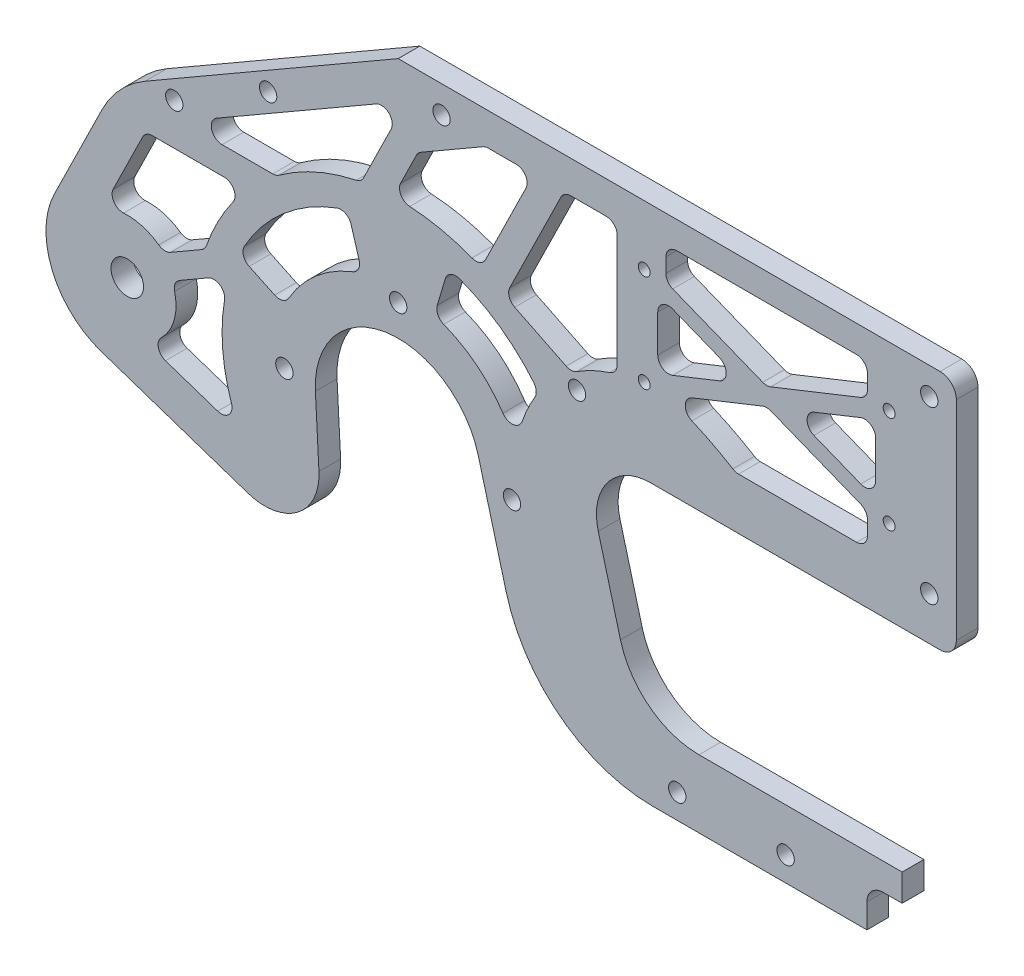
from build123d import *

# Parameters (mm, degrees)
SKETCH_1_R           = 15.3
SKETCH_1_R_2         = 3
EXTRUDE_1_DEPTH      = 4
SKETCH_2_R           = 1.6
CUT_EXTRUDE_1_DEPTH  = 120.268604419
FILLET_1_R           = 10
FILLET_2_R           = 15
SKETCH_3_R           = 1.1
CUT_EXTRUDE_2_DEPTH  = 120.268604419
CUT_EXTRUDE_4_DEPTH  = 120.268604419
SKETCH_8_R           = 1.6
CUT_EXTRUDE_7_DEPTH  = 120.268604419
SKETCH_10_W          = 6.5
SKETCH_10_H          = 7.5
CUT_EXTRUDE_8_DEPTH  = 120.268604419
SKETCH_17_R          = 1.6
CUT_EXTRUDE_14_DEPTH = 120.268604419
FILLET_3_R           = 3
CUT_EXTRUDE_13_DEPTH = 120.268604419
FILLET_5_R           = 10
FILLET_6_R           = 28
FILLET_7_R           = 2
CUT_EXTRUDE_15_DEPTH = 10
FILLET_8_R           = 2
FILLET_9_R           = 3
FILLET_10_R          = 20
SKETCH_20_R          = 1.6
CUT_EXTRUDE_16_DEPTH = 120.268604559


with BuildPart() as part:
    # 草图1 → 凸台-拉伸1 (new body)
    with BuildSketch(Plane.XY):
        with BuildLine():
            Line((103, 60), (0, 60))
            Line((0, 60), (-51.961524227, 30))
            Line((-51.961524227, 30), (-63.460189368, 6.619917082))
            ThreePointArc((-63.460189368, 6.619917082), (-63.846826311, -5.767616589), (-54.78066704, -14.217778401))
            Line((-54.78066704, -14.217778401), (10, -36))
            Line((10, -36), (93, -36))
            Line((93, -36), (93, -23.5))
            Line((93, -23.5), (44, -23.5))
            Line((44, -23.5), (33.549981495, 15.5))
            Line((33.549981495, 15.5), (103, 15.5))
            Line((103, 15.5), (103, 60))
        make_face()
        Circle(SKETCH_1_R, mode=Mode.SUBTRACT)
        with Locations((-50, 0)):
            Circle(SKETCH_1_R_2, mode=Mode.SUBTRACT)
    extrude(amount=EXTRUDE_1_DEPTH)

    # 草图2 → 切除-拉伸1 (cut, through all)
    with BuildSketch(Plane.XY):
        with Locations((0, 21)):
            Circle(SKETCH_2_R)
        with Locations((21, 0)):
            Circle(SKETCH_2_R)
        with Locations((0, -21)):
            Circle(SKETCH_2_R)
        with Locations((-21, 0)):
            Circle(SKETCH_2_R)
    extrude(amount=CUT_EXTRUDE_1_DEPTH, mode=Mode.SUBTRACT)

    # 圆角1
    fillet_1_edges = [part.edges().sort_by_distance(p)[0] for p in [
        (33.549981495, 15.5, 2),
    ]]
    fillet(fillet_1_edges, radius=FILLET_1_R)

    # 圆角2
    fillet_2_edges = [part.edges().sort_by_distance(p)[0] for p in [
        (44, -23.5, 2),
    ]]
    fillet(fillet_2_edges, radius=FILLET_2_R)

    # 草图3 → 切除-拉伸2 (cut, through all)
    with BuildSketch(Plane.XY):
        with Locations((90.6, 49)):
            Circle(SKETCH_3_R)
        with Locations((45.4, 49)):
            Circle(SKETCH_3_R)
        with Locations((45.4, 31)):
            Circle(SKETCH_3_R)
        with Locations((90.6, 31)):
            Circle(SKETCH_3_R)
    extrude(amount=CUT_EXTRUDE_2_DEPTH, mode=Mode.SUBTRACT)

    # 草图7 → 切除-拉伸4 (cut, through all)
    with BuildSketch(Plane.XY.offset(4)):
        Polygon((14.778665142, 3.95993139), (25.485896488, -36), (10, -36), (-13.854681439, -27.978965623), (-15.279031882, -0.800740131), align=None)
    extrude(amount=-CUT_EXTRUDE_4_DEPTH, mode=Mode.SUBTRACT)

    # 草图8 → 切除-拉伸7 (cut, through all)
    with BuildSketch(Plane.XY.offset(4)):
        with Locations((71.5, -31.5)):
            Circle(SKETCH_8_R)
        with Locations((51.5, -31.5)):
            Circle(SKETCH_8_R)
    extrude(amount=-CUT_EXTRUDE_7_DEPTH, mode=Mode.SUBTRACT)

    # 草图10 → 切除-拉伸8 (cut, through all)
    with BuildSketch(Plane.XY.offset(4)):
        with Locations((89.75, -32.25)):
            Rectangle(SKETCH_10_W, SKETCH_10_H)
    extrude(amount=-CUT_EXTRUDE_8_DEPTH, mode=Mode.SUBTRACT)

    # 草图17 → 切除-拉伸14 (cut, through all)
    with BuildSketch(Plane(origin=(0, 0, 0), x_dir=(-1, 0, 0), z_dir=(0, 0, -1))):
        with Locations((-98, 23.5)):
            Circle(SKETCH_17_R)
        with Locations((-98, 55)):
            Circle(SKETCH_17_R)
        with Locations((-33, 23.5)):
            Circle(SKETCH_17_R)
        with Locations((-8, 55)):
            Circle(SKETCH_17_R)
    extrude(amount=-CUT_EXTRUDE_14_DEPTH, mode=Mode.SUBTRACT)

    # 圆角3
    fillet_3_edges = [part.edges().sort_by_distance(p)[0] for p in [
        (86.5, -28.5, 2),
    ]]
    fillet(fillet_3_edges, radius=FILLET_3_R)

    # 草图16 → 切除-拉伸13 (cut, through all)
    with BuildSketch(Plane(origin=(0, 0, 0), x_dir=(-1, 0, 0), z_dir=(0, 0, -1))):
        with BuildLine():
            Line((39.961524227, 30), (-1.607695155, 54))
            Line((-1.607695155, 54), (6.814297559, 36.875674215))
            ThreePointArc((6.814297559, 36.875674215), (15.054923923, 34.345294666), (22.5, 30))
            Line((22.5, 30), (39.961524227, 30))
        make_face()
        with BuildLine():
            ThreePointArc((-15.291983375, 34.240403684), (-7.356917416, 36.771262776), (0.941066362, 37.488190062))
            Line((0.941066362, 37.488190062), (-3.64437594, 46.811708914))
            Line((-3.64437594, 46.811708914), (-16.09486132, 54))
            Line((-16.09486132, 54), (-25.010040499, 54))
            Line((-25.010040499, 54), (-15.291983375, 34.240403684))
        make_face()
        with BuildLine():
            Line((46.619815234, 25), (27.950849719, 25))
            ThreePointArc((27.950849719, 25), (32.471948005, 18.756934525), (35.621057217, 11.721360106))
            Line((35.621057217, 11.721360106), (43.209001074, 7.340458677))
            ThreePointArc((43.209001074, 7.340458677), (48.622799445, 9.904711941), (54.53080083, 8.914698191))
            Line((54.53080083, 8.914698191), (46.619815234, 25))
        make_face()
        with BuildLine():
            Line((-32.04223411, 25.83687212), (-19.713165533, 31.90048753))
            Line((-19.713165533, 31.90048753), (-30.582027486, 54))
            Line((-30.582027486, 54), (-40.4, 54))
            Line((-40.4, 54), (-40.4, 29.7235416))
            ThreePointArc((-40.4, 29.7235416), (-36.04044602, 28.168715896), (-32.04223411, 25.83687212))
        make_face()
        with BuildLine():
            ThreePointArc((-9.285714286, 31.145232544), (-18.532162822, 26.698482001), (-25.931616603, 19.590846341))
            ThreePointArc((-25.931616603, 19.590846341), (-23.156784039, 14.232023638), (-21.7468748, 8.364414888))
            ThreePointArc((-21.7468748, 8.364414888), (-15.825536971, 17.100946745), (-6.657142857, 22.328735947))
            Line((-6.657142857, 22.328735947), (-9.285714286, 31.145232544))
        make_face()
        with BuildLine():
            Line((-86.6, 25), (-62.226723071, 25))
            ThreePointArc((-62.226723071, 25), (-56.006442917, 28.40343886), (-49.4, 30.978355023))
            Line((-49.4, 30.978355023), (-68, 38.385434669))
            Line((-68, 38.385434669), (-86.6, 30.978355023))
            Line((-86.6, 30.978355023), (-86.6, 25))
        make_face()
        with BuildLine():
            ThreePointArc((29.364006844, 13.928571429), (21.155462435, 24.671773531), (9.285714286, 31.145232544))
            Line((9.285714286, 31.145232544), (6.657142857, 22.328735947))
            ThreePointArc((6.657142857, 22.328735947), (15.166839223, 17.687763793), (21.051734138, 9.985714286))
            Line((21.051734138, 9.985714286), (29.364006844, 13.928571429))
        make_face()
        Polygon((-72.054352942, 40), (-88.1, 46.389859448), (-88.1, 33.610140552), align=None)
        Polygon((-47.9, 33.610140552), (-47.9, 46.389859448), (-63.945647058, 40), align=None)
        Polygon((-86.6, 55), (-86.6, 49.021644977), (-68, 41.614565331), (-49.4, 49.021644977), (-49.4, 55), align=None)
    extrude(amount=-CUT_EXTRUDE_13_DEPTH, mode=Mode.SUBTRACT)

    # 圆角5
    fillet_5_edges = [part.edges().sort_by_distance(p)[0] for p in [
        (-13.854681439, -27.978965623, 2),
    ]]
    fillet(fillet_5_edges, radius=FILLET_5_R)

    # 圆角6
    fillet_6_edges = [part.edges().sort_by_distance(p)[0] for p in [
        (25.485896488, -36, 2),
    ]]
    fillet(fillet_6_edges, radius=FILLET_6_R)

    # 圆角7
    fillet_7_edges = [part.edges().sort_by_distance(p)[0] for p in [
        (1.607695155, 54, 2),
        (-39.961524227, 30, 2),
        (-22.5, 30, 2),
        (-6.814297559, 36.875674215, 2),
        (-35.621057217, 11.721360106, 2),
        (-27.950849719, 25, 2),
        (-46.619815234, 25, 2),
        (-54.53080083, 8.914698191, 2),
        (-43.209001074, 7.340458677, 2),
        (9.285714286, 31.145232544, 2),
        (6.657142857, 22.328735947, 2),
        (25.931616603, 19.590846341, 2),
        (40.4, 54, 2),
        (30.582027486, 54, 2),
        (40.4, 29.7235416, 2),
        (25.010040499, 54, 2),
        (-0.941066362, 37.488190062, 2),
        (15.291983375, 34.240403684, 2),
        (47.9, 46.389859448, 2),
        (47.9, 33.610140552, 2),
        (63.945647058, 40, 2),
        (68, 38.385434669, 2),
        (88.1, 46.389859448, 2),
        (72.054352942, 40, 2),
        (88.1, 33.610140552, 2),
        (68, 41.614565331, 2),
        (-21.051734138, 9.985714286, 2),
        (-6.657142857, 22.328735947, 2),
        (-9.285714286, 31.145232544, 2),
        (-29.364006844, 13.928571429, 2),
        (21.7468748, 8.364414888, 2),
        (32.04223411, 25.83687212, 2),
        (86.6, 25, 2),
        (86.6, 30.978355023, 2),
        (62.226723071, 25, 2),
        (86.6, 49.021644977, 2),
        (86.6, 55, 2),
        (49.4, 55, 2),
        (49.4, 49.021644977, 2),
        (19.713165533, 31.90048753, 2),
        (49.4, 30.978355023, 2),
        (3.64437594, 46.811708914, 2),
        (16.09486132, 54, 2),
    ]]
    fillet(fillet_7_edges, radius=FILLET_7_R)

    # 草图18 → 切除-拉伸15 (cut)
    with BuildSketch(Plane(origin=(0, 0, 0), x_dir=(-1, 0, 0), z_dir=(0, 0, -1))):
        with BuildLine():
            Line((41.738593422, 3.570596778), (30.995796101, 9.772953703))
            ThreePointArc((30.995796101, 9.772953703), (32.121747876, 4.944017937), (32.5, 0))
            ThreePointArc((32.5, 0), (31.647656776, -7.394310015), (29.135334117, -14.40077449))
            Line((29.135334117, -14.40077449), (46.869117941, -8.437865698))
            ThreePointArc((46.869117941, -8.437865698), (41.72371745, -3.535978952), (41.738593422, 3.570596778))
        make_face()
    extrude(amount=-CUT_EXTRUDE_15_DEPTH, mode=Mode.SUBTRACT)

    # 圆角8
    fillet_8_edges = [part.edges().sort_by_distance(p)[0] for p in [
        (-29.135334117, -14.40077449, 2),
        (-41.738593422, 3.570596778, 2),
        (-46.869117941, -8.437865698, 2),
        (-30.995796101, 9.772953703, 2),
    ]]
    fillet(fillet_8_edges, radius=FILLET_8_R)

    # 圆角9
    fillet_9_edges = [part.edges().sort_by_distance(p)[0] for p in [
        (103, 60, 2),
        (103, 15.5, 2),
    ]]
    fillet(fillet_9_edges, radius=FILLET_9_R)

    # 圆角10
    fillet_10_edges = [part.edges().sort_by_distance(p)[0] for p in [
        (-51.961524227, 30, 2),
    ]]
    fillet(fillet_10_edges, radius=FILLET_10_R)

    # 草图20 → 切除-拉伸16 (cut, through all)
    with BuildSketch(Plane(origin=(0, 0, 0), x_dir=(-1, 0, 0), z_dir=(0, 0, -1))):
        with Locations((24, 42.679491924)):
            Circle(SKETCH_20_R)
        with Locations((41.320508076, 32.679491924)):
            Circle(SKETCH_20_R)
    extrude(amount=-CUT_EXTRUDE_16_DEPTH, mode=Mode.SUBTRACT)


solid = part.part
